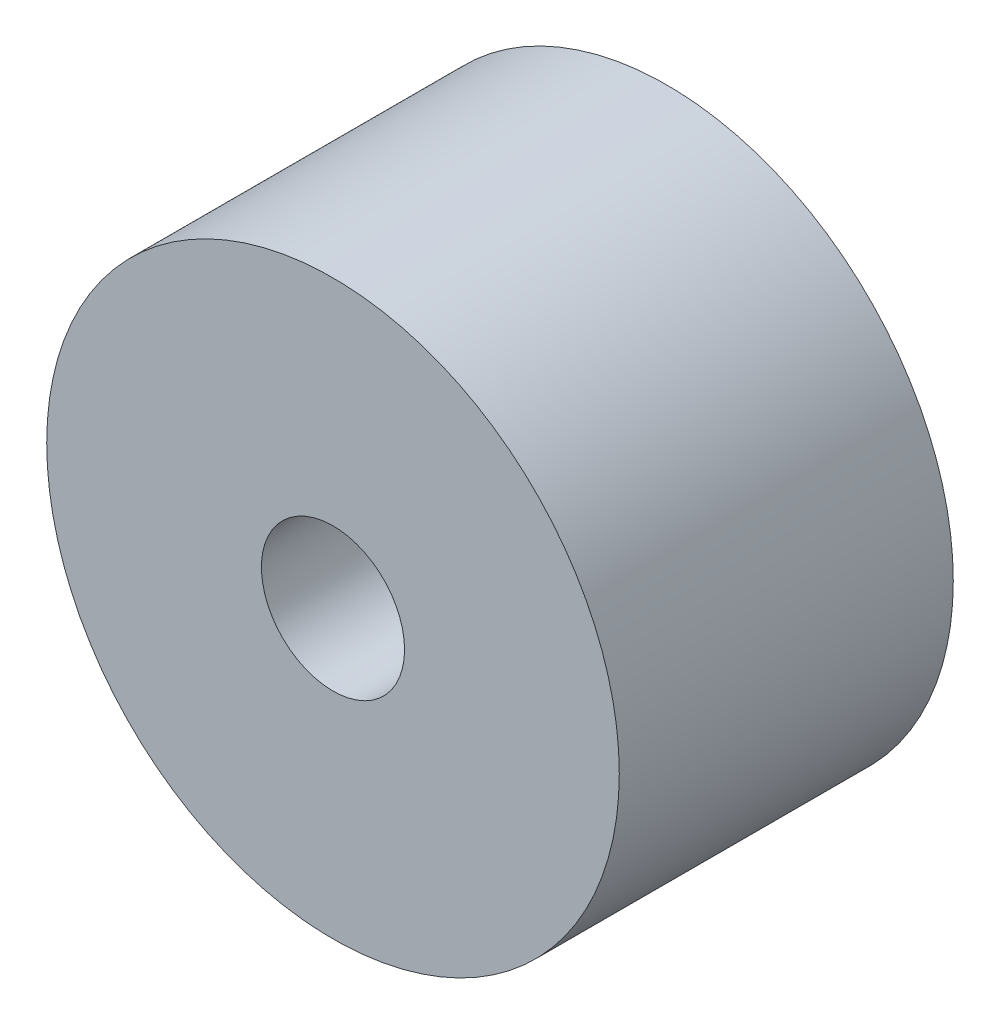
from build123d import *

# Parameters (mm, degrees)
ESQUISSE1_R        = 0.75
BOSS_EXTRU_1_DEPTH = 3.5
ESQUISSE2_R        = 3
ESQUISSE2_R_2      = 0.75
BOSS_EXTRU_2_DEPTH = 3.5


with BuildPart() as part:
    # Esquisse1 → Boss.-Extru.1 (new body)
    with BuildSketch(Plane.XY):
        with BuildLine():
            ThreePointArc((2.977310095, 0.368272455), (2.955741127, 0.513414445), (2.927100903, 0.657328154))
            add(Edge.make_bspline(
                [(2.211403727, 0.79214554), (2.222779445, 0.796220429), (2.274133198, 0.805614359), (2.359373738, 0.810478726), (2.538607422, 0.796225963), (2.732062921, 0.744216047), (2.878239296, 0.681280138), (2.927100903, 0.657328154)],
                knots=[0, 0, 0, 0, 0.036250587, 0.155621312, 0.255291203, 0.575254513, 0.744084786, 0.744084786, 0.744084786, 0.744084786], degree=3))
            add(Edge.make_bspline(
                [(2.211403727, 0.79214554), (2.132130324, 0.763749064), (1.99001212, 0.681956821), (1.750090704, 0.694113528), (1.707279056, 0.775127876)],
                knots=[0, 0, 0, 0, 0.252617676, 0.527509393, 0.527509393, 0.527509393, 0.527509393], degree=3))
            ThreePointArc((1.707279056, 0.775127876), (1.657764419, 0.876037746), (1.602292085, 0.973799299))
            add(Edge.make_bspline(
                [(1.90038092, 1.380707558), (1.832256922, 1.331212576), (1.684611138, 1.259880414), (1.559480437, 1.054813647), (1.602292085, 0.973799299)],
                knots=[0, 0, 0, 0, 0.252617676, 0.527509393, 0.527509393, 0.527509393, 0.527509393], degree=3))
            add(Edge.make_bspline(
                [(1.90038092, 1.380707558), (1.9101567, 1.387810078), (1.946851003, 1.424944725), (1.998895263, 1.49262786), (2.088102134, 1.648736761), (2.154127637, 1.837868182), (2.184488772, 1.994094501), (2.192229346, 2.04795764)],
                knots=[0, 0, 0, 0, 0.036250587, 0.155621312, 0.255291203, 0.575254513, 0.744084786, 0.744084786, 0.744084786, 0.744084786], degree=3))
            ThreePointArc((2.192229346, 2.04795764), (2.089467363, 2.152702055), (1.98170658, 2.25229639))
            add(Edge.make_bspline(
                [(1.32345173, 1.940689701), (1.33025972, 1.950672835), (1.366284165, 1.988457663), (1.432386008, 2.04249615), (1.585766668, 2.136316339), (1.772846116, 2.207949723), (1.928098087, 2.242953821), (1.98170658, 2.25229639)],
                knots=[0, 0, 0, 0, 0.036250587, 0.155621312, 0.255291203, 0.575254513, 0.744084786, 0.744084786, 0.744084786, 0.744084786], degree=3))
            add(Edge.make_bspline(
                [(1.32345173, 1.940689701), (1.27600923, 1.871120733), (1.209109462, 1.721414433), (1.007863426, 1.590227146), (0.925609036, 1.630605075)],
                knots=[0, 0, 0, 0, 0.252617676, 0.527509393, 0.527509393, 0.527509393, 0.527509393], degree=3))
            ThreePointArc((0.925609036, 1.630605075), (0.82623752, 1.683138901), (0.72389666, 1.729623839))
            add(Edge.make_bspline(
                [(0.72588092, 2.234031757), (0.699859868, 2.153947194), (0.622339913, 2.009454248), (0.641642271, 1.770001768), (0.72389666, 1.729623839)],
                knots=[0, 0, 0, 0, 0.252617676, 0.527509393, 0.527509393, 0.527509393, 0.527509393], degree=3))
            add(Edge.make_bspline(
                [(0.72588092, 2.234031757), (0.729614936, 2.245523876), (0.737474053, 2.297134806), (0.739795594, 2.382482461), (0.720206959, 2.561211698), (0.662454053, 2.753031049), (0.595189201, 2.897266624), (0.569791499, 2.945392614)],
                knots=[0, 0, 0, 0, 0.036250587, 0.155621312, 0.255291203, 0.575254513, 0.744084786, 0.744084786, 0.744084786, 0.744084786], degree=3))
            ThreePointArc((0.569791499, 2.945392614), (0.425088085, 2.969730648), (0.279367699, 2.986963958))
            add(Edge.make_bspline(
                [(-0.070013845, 2.347956359), (-0.070374004, 2.360034519), (-0.063438981, 2.411777724), (-0.041724492, 2.494349468), (0.027216945, 2.660406485), (0.136462351, 2.82832165), (0.241488941, 2.947895379), (0.279367699, 2.986963958)],
                knots=[0, 0, 0, 0, 0.036250587, 0.155621312, 0.255291203, 0.575254513, 0.744084786, 0.744084786, 0.744084786, 0.744084786], degree=3))
            add(Edge.make_bspline(
                [(-0.070013845, 2.347956359), (-0.06750402, 2.263787878), (-0.033631914, 2.103350241), (-0.119333425, 1.878928045), (-0.209612175, 1.863246558)],
                knots=[0, 0, 0, 0, 0.252617676, 0.527509393, 0.527509393, 0.527509393, 0.527509393], degree=3))
            ThreePointArc((-0.209612175, 1.863246558), (-0.320884028, 1.847338204), (-0.431002684, 1.824790861))
            add(Edge.make_bspline(
                [(-0.72588092, 2.234031757), (-0.699859868, 2.153947194), (-0.677644007, 1.991484859), (-0.521281435, 1.809109374), (-0.431002684, 1.824790861)],
                knots=[0, 0, 0, 0, 0.252617676, 0.527509393, 0.527509393, 0.527509393, 0.527509393], degree=3))
            add(Edge.make_bspline(
                [(-0.72588092, 2.234031757), (-0.729614936, 2.245523876), (-0.75359292, 2.291897469), (-0.801880846, 2.36230974), (-0.922782795, 2.495390819), (-1.082254463, 2.616629628), (-1.221452415, 2.693781371), (-1.270287335, 2.717787719)],
                knots=[0, 0, 0, 0, 0.036250587, 0.155621312, 0.255291203, 0.575254513, 0.744084786, 0.744084786, 0.744084786, 0.744084786], degree=3))
            ThreePointArc((-1.270287335, 2.717787719), (-1.401660393, 2.65242307), (-1.529680147, 2.580712818))
            add(Edge.make_bspline(
                [(-1.436736511, 1.858383491), (-1.44412725, 1.867943232), (-1.468930592, 1.913880668), (-1.499897654, 1.993446068), (-1.541728726, 2.168311777), (-1.552045394, 2.368370838), (-1.537360771, 2.526841097), (-1.529680147, 2.580712818)],
                knots=[0, 0, 0, 0, 0.036250587, 0.155621312, 0.255291203, 0.575254513, 0.744084786, 0.744084786, 0.744084786, 0.744084786], degree=3))
            add(Edge.make_bspline(
                [(-1.436736511, 1.858383491), (-1.385233029, 1.791764998), (-1.263527042, 1.681877747), (-1.200948963, 1.449942292), (-1.26476866, 1.384191185)],
                knots=[0, 0, 0, 0, 0.252617676, 0.527509393, 0.527509393, 0.527509393, 0.527509393], degree=3))
            ThreePointArc((-1.26476866, 1.384191185), (-1.345438785, 1.305917102), (-1.421273653, 1.222949796))
            add(Edge.make_bspline(
                [(-1.90038092, 1.380707558), (-1.832256922, 1.331212576), (-1.718790948, 1.212835941), (-1.48509335, 1.157198689), (-1.421273653, 1.222949796)],
                knots=[0, 0, 0, 0, 0.252617676, 0.527509393, 0.527509393, 0.527509393, 0.527509393], degree=3))
            add(Edge.make_bspline(
                [(-1.90038092, 1.380707558), (-1.9101567, 1.387810078), (-1.956813011, 1.411233197), (-2.037266059, 1.43981499), (-2.213300886, 1.476415463), (-2.413578559, 1.480764624), (-2.571540724, 1.461363192), (-2.625159582, 1.45208029)],
                knots=[0, 0, 0, 0, 0.036250587, 0.155621312, 0.255291203, 0.575254513, 0.744084786, 0.744084786, 0.744084786, 0.744084786], degree=3))
            ThreePointArc((-2.625159582, 1.45208029), (-2.693022242, 1.321980032), (-2.75444217, 1.188717096))
            add(Edge.make_bspline(
                [(-2.254674663, 0.658971294), (-2.266272971, 0.662361119), (-2.313340644, 0.684946248), (-2.385160892, 0.731114025), (-2.521786425, 0.847995669), (-2.64772455, 1.003782864), (-2.728990923, 1.140619401), (-2.75444217, 1.188717096)],
                knots=[0, 0, 0, 0, 0.036250587, 0.155621312, 0.255291203, 0.575254513, 0.744084786, 0.744084786, 0.744084786, 0.744084786], degree=3))
            add(Edge.make_bspline(
                [(-2.254674663, 0.658971294), (-2.173850103, 0.635348788), (-2.010797786, 0.617985118), (-1.823842817, 0.467127866), (-1.836826505, 0.376421826)],
                knots=[0, 0, 0, 0, 0.252617676, 0.527509393, 0.527509393, 0.527509393, 0.527509393], degree=3))
            ThreePointArc((-1.836826505, 0.376421826), (-1.856081655, 0.265680053), (-1.868666393, 0.153983476))
            add(Edge.make_bspline(
                [(-2.349, 0), (-2.264794108, 0), (-2.103418166, -0.029075083), (-1.881650081, 0.063277436), (-1.868666393, 0.153983476)],
                knots=[0, 0, 0, 0, 0.252617676, 0.527509393, 0.527509393, 0.527509393, 0.527509393], degree=3))
            add(Edge.make_bspline(
                [(-2.349, 0), (-2.361083529, 0), (-2.412597041, -0.00847419), (-2.494484881, -0.032640149), (-2.658413265, -0.106500419), (-2.822997679, -0.220702136), (-2.93938788, -0.329246056), (-2.977310095, -0.368272455)],
                knots=[0, 0, 0, 0, 0.036250587, 0.155621312, 0.255291203, 0.575254513, 0.744084786, 0.744084786, 0.744084786, 0.744084786], degree=3))
            ThreePointArc((-2.977310095, -0.368272455), (-2.955741127, -0.513414445), (-2.927100903, -0.657328154))
            add(Edge.make_bspline(
                [(-2.211403727, -0.79214554), (-2.222779445, -0.796220429), (-2.274133198, -0.805614359), (-2.359373738, -0.810478726), (-2.538607422, -0.796225963), (-2.732062921, -0.744216047), (-2.878239296, -0.681280138), (-2.927100903, -0.657328154)],
                knots=[0, 0, 0, 0, 0.036250587, 0.155621312, 0.255291203, 0.575254513, 0.744084786, 0.744084786, 0.744084786, 0.744084786], degree=3))
            add(Edge.make_bspline(
                [(-2.211403727, -0.79214554), (-2.132130324, -0.763749064), (-1.99001212, -0.681956821), (-1.750090704, -0.694113528), (-1.707279056, -0.775127876)],
                knots=[0, 0, 0, 0, 0.252617676, 0.527509393, 0.527509393, 0.527509393, 0.527509393], degree=3))
            ThreePointArc((-1.707279056, -0.775127876), (-1.657764419, -0.876037746), (-1.602292085, -0.973799299))
            add(Edge.make_bspline(
                [(-1.90038092, -1.380707558), (-1.832256922, -1.331212576), (-1.684611138, -1.259880414), (-1.559480437, -1.054813647), (-1.602292085, -0.973799299)],
                knots=[0, 0, 0, 0, 0.252617676, 0.527509393, 0.527509393, 0.527509393, 0.527509393], degree=3))
            add(Edge.make_bspline(
                [(-1.90038092, -1.380707558), (-1.9101567, -1.387810078), (-1.946851003, -1.424944725), (-1.998895263, -1.49262786), (-2.088102134, -1.648736761), (-2.154127637, -1.837868182), (-2.184488772, -1.994094501), (-2.192229346, -2.04795764)],
                knots=[0, 0, 0, 0, 0.036250587, 0.155621312, 0.255291203, 0.575254513, 0.744084786, 0.744084786, 0.744084786, 0.744084786], degree=3))
            ThreePointArc((-2.192229346, -2.04795764), (-2.089467363, -2.152702055), (-1.98170658, -2.25229639))
            add(Edge.make_bspline(
                [(-1.32345173, -1.940689701), (-1.33025972, -1.950672835), (-1.366284165, -1.988457663), (-1.432386008, -2.04249615), (-1.585766668, -2.136316339), (-1.772846116, -2.207949723), (-1.928098087, -2.242953821), (-1.98170658, -2.25229639)],
                knots=[0, 0, 0, 0, 0.036250587, 0.155621312, 0.255291203, 0.575254513, 0.744084786, 0.744084786, 0.744084786, 0.744084786], degree=3))
            add(Edge.make_bspline(
                [(-1.32345173, -1.940689701), (-1.27600923, -1.871120733), (-1.209109462, -1.721414433), (-1.007863426, -1.590227146), (-0.925609036, -1.630605075)],
                knots=[0, 0, 0, 0, 0.252617676, 0.527509393, 0.527509393, 0.527509393, 0.527509393], degree=3))
            ThreePointArc((-0.925609036, -1.630605075), (-0.82623752, -1.683138901), (-0.72389666, -1.729623839))
            add(Edge.make_bspline(
                [(-0.72588092, -2.234031757), (-0.699859868, -2.153947194), (-0.622339913, -2.009454248), (-0.641642271, -1.770001768), (-0.72389666, -1.729623839)],
                knots=[0, 0, 0, 0, 0.252617676, 0.527509393, 0.527509393, 0.527509393, 0.527509393], degree=3))
            add(Edge.make_bspline(
                [(-0.72588092, -2.234031757), (-0.729614936, -2.245523876), (-0.737474053, -2.297134806), (-0.739795594, -2.382482461), (-0.720206959, -2.561211698), (-0.662454053, -2.753031049), (-0.595189201, -2.897266624), (-0.569791499, -2.945392614)],
                knots=[0, 0, 0, 0, 0.036250587, 0.155621312, 0.255291203, 0.575254513, 0.744084786, 0.744084786, 0.744084786, 0.744084786], degree=3))
            ThreePointArc((-0.569791499, -2.945392614), (-0.425088085, -2.969730648), (-0.279367699, -2.986963958))
            add(Edge.make_bspline(
                [(0.070013845, -2.347956359), (0.070374004, -2.360034519), (0.063438981, -2.411777724), (0.041724492, -2.494349468), (-0.027216945, -2.660406485), (-0.136462351, -2.82832165), (-0.241488941, -2.947895379), (-0.279367699, -2.986963958)],
                knots=[0, 0, 0, 0, 0.036250587, 0.155621312, 0.255291203, 0.575254513, 0.744084786, 0.744084786, 0.744084786, 0.744084786], degree=3))
            add(Edge.make_bspline(
                [(0.070013845, -2.347956359), (0.06750402, -2.263787879), (0.033631914, -2.103350241), (0.119333425, -1.878928045), (0.209612175, -1.863246558)],
                knots=[0, 0, 0, 0, 0.252617676, 0.527509393, 0.527509393, 0.527509393, 0.527509393], degree=3))
            ThreePointArc((0.209612175, -1.863246558), (0.320884028, -1.847338204), (0.431002684, -1.824790861))
            add(Edge.make_bspline(
                [(0.72588092, -2.234031757), (0.699859868, -2.153947194), (0.677644007, -1.991484859), (0.521281435, -1.809109374), (0.431002684, -1.824790861)],
                knots=[0, 0, 0, 0, 0.252617676, 0.527509393, 0.527509393, 0.527509393, 0.527509393], degree=3))
            add(Edge.make_bspline(
                [(0.72588092, -2.234031757), (0.729614936, -2.245523876), (0.75359292, -2.291897469), (0.801880846, -2.36230974), (0.922782795, -2.495390819), (1.082254463, -2.616629628), (1.221452415, -2.693781371), (1.270287335, -2.717787719)],
                knots=[0, 0, 0, 0, 0.036250587, 0.155621312, 0.255291203, 0.575254513, 0.744084786, 0.744084786, 0.744084786, 0.744084786], degree=3))
            ThreePointArc((1.270287335, -2.717787719), (1.401660393, -2.65242307), (1.529680147, -2.580712818))
            add(Edge.make_bspline(
                [(1.436736511, -1.858383491), (1.44412725, -1.867943232), (1.468930592, -1.913880668), (1.499897654, -1.993446068), (1.541728726, -2.168311777), (1.552045394, -2.368370838), (1.537360771, -2.526841097), (1.529680147, -2.580712818)],
                knots=[0, 0, 0, 0, 0.036250587, 0.155621312, 0.255291203, 0.575254513, 0.744084786, 0.744084786, 0.744084786, 0.744084786], degree=3))
            add(Edge.make_bspline(
                [(1.436736511, -1.858383491), (1.385233029, -1.791764998), (1.263527042, -1.681877747), (1.200948963, -1.449942292), (1.26476866, -1.384191185)],
                knots=[0, 0, 0, 0, 0.252617676, 0.527509393, 0.527509393, 0.527509393, 0.527509393], degree=3))
            ThreePointArc((1.26476866, -1.384191185), (1.345438785, -1.305917102), (1.421273653, -1.222949796))
            add(Edge.make_bspline(
                [(1.90038092, -1.380707558), (1.832256922, -1.331212576), (1.718790948, -1.212835941), (1.48509335, -1.157198689), (1.421273653, -1.222949796)],
                knots=[0, 0, 0, 0, 0.252617676, 0.527509393, 0.527509393, 0.527509393, 0.527509393], degree=3))
            add(Edge.make_bspline(
                [(1.90038092, -1.380707558), (1.9101567, -1.387810078), (1.956813011, -1.411233197), (2.037266059, -1.43981499), (2.213300886, -1.476415463), (2.413578559, -1.480764624), (2.571540724, -1.461363192), (2.625159582, -1.45208029)],
                knots=[0, 0, 0, 0, 0.036250587, 0.155621312, 0.255291203, 0.575254513, 0.744084786, 0.744084786, 0.744084786, 0.744084786], degree=3))
            ThreePointArc((2.625159582, -1.45208029), (2.693022242, -1.321980032), (2.75444217, -1.188717096))
            add(Edge.make_bspline(
                [(2.254674663, -0.658971294), (2.266272971, -0.662361119), (2.313340644, -0.684946248), (2.385160892, -0.731114025), (2.521786425, -0.847995669), (2.64772455, -1.003782864), (2.728990923, -1.140619401), (2.75444217, -1.188717096)],
                knots=[0, 0, 0, 0, 0.036250587, 0.155621312, 0.255291203, 0.575254513, 0.744084786, 0.744084786, 0.744084786, 0.744084786], degree=3))
            add(Edge.make_bspline(
                [(2.254674663, -0.658971294), (2.173850103, -0.635348788), (2.010797786, -0.617985118), (1.823842817, -0.467127866), (1.836826505, -0.376421826)],
                knots=[0, 0, 0, 0, 0.252617676, 0.527509393, 0.527509393, 0.527509393, 0.527509393], degree=3))
            ThreePointArc((1.836826505, -0.376421826), (1.856081655, -0.265680053), (1.868666393, -0.153983476))
            add(Edge.make_bspline(
                [(2.349, 0), (2.264794108, 0), (2.103418166, 0.029075083), (1.881650081, -0.063277436), (1.868666393, -0.153983476)],
                knots=[0, 0, 0, 0, 0.252617676, 0.527509393, 0.527509393, 0.527509393, 0.527509393], degree=3))
            add(Edge.make_bspline(
                [(2.349, 0), (2.361083529, 0), (2.412597041, 0.00847419), (2.494484881, 0.032640149), (2.658413265, 0.106500419), (2.822997679, 0.220702136), (2.93938788, 0.329246056), (2.977310095, 0.368272455)],
                knots=[0, 0, 0, 0, 0.036250587, 0.155621312, 0.255291203, 0.575254513, 0.744084786, 0.744084786, 0.744084786, 0.744084786], degree=3))
        make_face()
        Circle(ESQUISSE1_R, mode=Mode.SUBTRACT)
    extrude(amount=BOSS_EXTRU_1_DEPTH)

    # Esquisse2 → Boss.-Extru.2 (add)
    with BuildSketch(Plane(origin=(0, 0, 0), x_dir=(-1, 0, 0), z_dir=(0, 0, -1))):
        with Locations(Location((0, 0, 0), (0, 0, 180))):
            Circle(ESQUISSE2_R)
        with Locations(Location((0, 0, 0), (0, 0, 180))):
            Circle(ESQUISSE2_R_2, mode=Mode.SUBTRACT)
    extrude(amount=-BOSS_EXTRU_2_DEPTH)


solid = part.part
